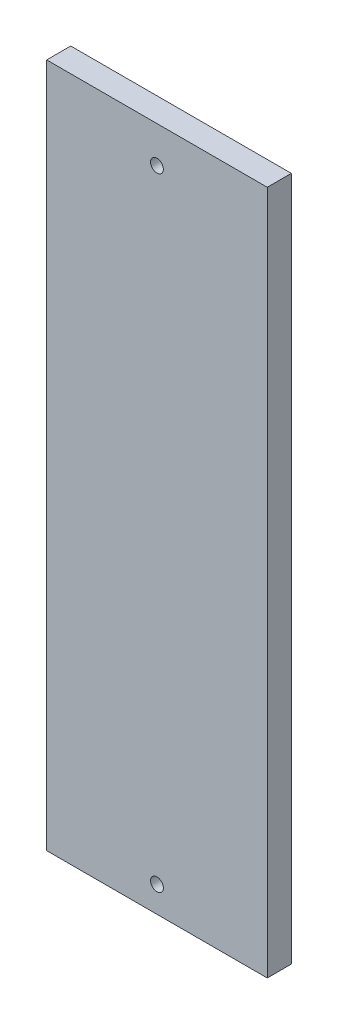
from build123d import *

# Parameters (mm, degrees)
SKETCH1_W            = 55
SKETCH1_H            = 164.75
BOSS_EXTRUDE1_DEPTH  = 6
M3_CLEARANCE_SLOT1_D = 3.2
SKETCH4_W            = 55
SKETCH4_H            = 6
BOSS_EXTRUDE2_DEPTH  = 6


with BuildPart() as part:
    # Sketch1 → Boss-Extrude1 (new body)
    with BuildSketch(Plane.XY):
        with Locations((27.5, 82.375)):
            Rectangle(SKETCH1_W, SKETCH1_H)
    extrude(amount=BOSS_EXTRUDE1_DEPTH)

    # M3 Clearance Slot1 (through all)
    with Locations(Plane(origin=(0, 0, 0), x_dir=(-1, 0, 0), z_dir=(0, 0, -1))):
        with Locations((-27.5, 161.67), (-27.5, 6.48)):
            Hole(M3_CLEARANCE_SLOT1_D / 2)

    # Sketch4 → Boss-Extrude2 (add)
    with BuildSketch(Plane(origin=(0, 164.75, 0), x_dir=(1, 0, 0), z_dir=(0, 1, 0))):
        with Locations((27.5, -3)):
            Rectangle(SKETCH4_W, SKETCH4_H)
    extrude(amount=BOSS_EXTRUDE2_DEPTH)


solid = part.part
